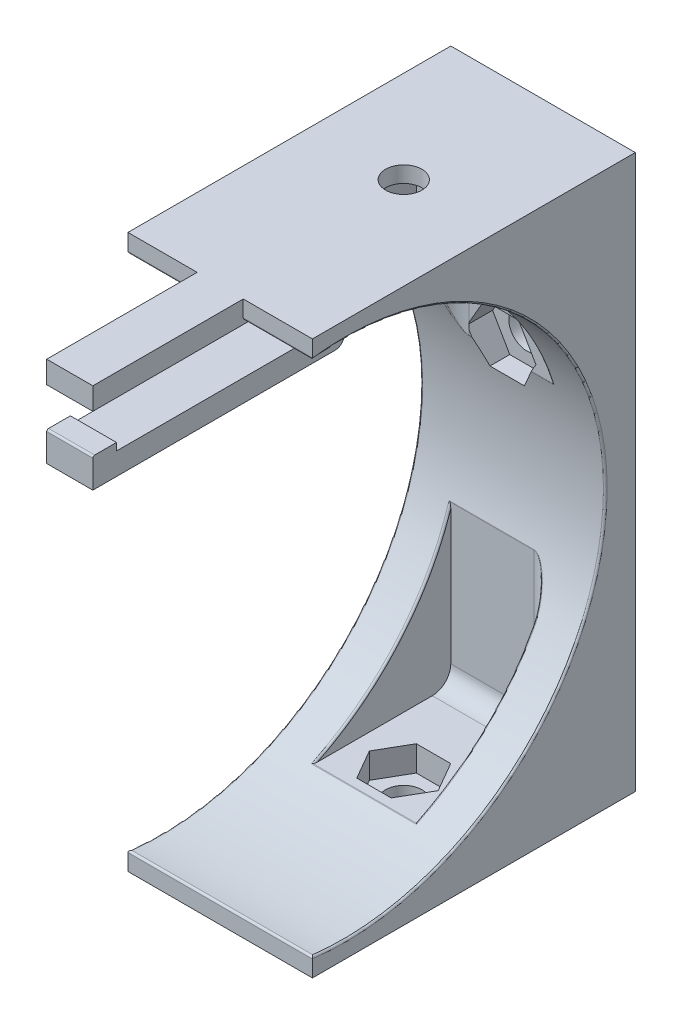
from build123d import *

# Parameters (mm, degrees)
SKETCH1_W               = 25.4
SKETCH1_H               = 76.2
BOSS_EXTRUDE1_DEPTH     = 44.45
SHELL1_T                = -5.715
CUT_EXTRUDE3_DEPTH      = 64.816710194
CUT_EXTRUDE3_DEPTH_BACK = 64.816710194
CUT_EXTRUDE4_DEPTH      = 90.126497182
CUT_EXTRUDE4_DEPTH_BACK = 90.126497182
SKETCH4_R               = 2.5
CUT_EXTRUDE5_DEPTH      = 56.796955338
CUT_EXTRUDE5_DEPTH_BACK = 56.796955338
SKETCH5_R               = 2.5
FILLET1_R               = 2.54
FILLET2_R               = 0.254
SKETCH7_R               = 2.5
CUT_EXTRUDE6_DEPTH      = 3.5
SKETCH8_R               = 2.5
CUT_EXTRUDE7_DEPTH      = 3.5
CUT_EXTRUDE8_START      = -3.5
SKETCH9_R               = 2.5
CUT_EXTRUDE8_DEPTH      = 3.5
SKETCH10_W              = 2.54
SKETCH10_H              = 6.35
BOSS_EXTRUDE2_DEPTH     = 3.175


with BuildPart() as part:
    # Sketch1 → Boss-Extrude1 (new body)
    with BuildSketch(Plane.XY):
        Rectangle(SKETCH1_W, SKETCH1_H)
    extrude(amount=BOSS_EXTRUDE1_DEPTH)

    # Shell1
    shell1_openings = [part.faces().sort_by_distance(p)[0] for p in [
        (0, 0, 44.45),
    ]]
    offset(amount=SHELL1_T, openings=shell1_openings, kind=Kind.INTERSECTION)

    # Sketch2 → Cut-Extrude3 (cut, two sides: drawn at the far end of the back side and taken through both)
    with BuildSketch(Plane(origin=(12.7, 0, 0), x_dir=(0, 0, -1), z_dir=(1, 0, 0)).offset(-CUT_EXTRUDE3_DEPTH_BACK)):
        with BuildLine():
            ThreePointArc((-36.413720818, -35.664362817), (-4.128213539, 0), (-36.413720818, 35.664362817))
            Line((-36.413720818, 35.664362817), (-36.413720818, -35.664362817))
        make_face()
        with BuildLine():
            Line((-36.413720818, -35.664362817), (-36.413720818, 35.664362817))
            ThreePointArc((-36.413720818, 35.664362817), (-40.434794926, 35.838148814), (-44.45, 35.56))
            Line((-44.45, 35.56), (-44.45, -35.56))
            ThreePointArc((-44.45, -35.56), (-40.434794926, -35.838148814), (-36.413720818, -35.664362817))
        make_face()
    extrude(amount=CUT_EXTRUDE3_DEPTH + CUT_EXTRUDE3_DEPTH_BACK, mode=Mode.SUBTRACT)

    # Sketch4 → Cut-Extrude4 (cut, two sides: drawn at the far end of the back side and taken through both)
    with BuildSketch(Plane(origin=(0, 38.1, 0), x_dir=(1, 0, 0), z_dir=(0, 1, 0)).offset(-CUT_EXTRUDE4_DEPTH_BACK)):
        with Locations(Location((0, -19.177, 0), (0, 0, 270))):
            Circle(SKETCH4_R)
    extrude(amount=CUT_EXTRUDE4_DEPTH + CUT_EXTRUDE4_DEPTH_BACK, mode=Mode.SUBTRACT)

    # Sketch5 → Cut-Extrude5 (cut, two sides: drawn at the far end of the back side and taken through both)
    with BuildSketch(Plane.XY.offset(5.715).offset(-CUT_EXTRUDE5_DEPTH_BACK)):
        with Locations((0, 11.684)):
            Circle(SKETCH5_R)
    extrude(amount=CUT_EXTRUDE5_DEPTH + CUT_EXTRUDE5_DEPTH_BACK, mode=Mode.SUBTRACT)

    # Fillet1
    fillet1_edges = [part.edges().sort_by_distance(p)[0] for p in [
        (6.985, -21.465702955, 5.715),
        (0, 32.385, 5.715),
        (-6.985, 21.465702955, 5.715),
        (0, -32.385, 5.715),
    ]]
    fillet(fillet1_edges, radius=FILLET1_R)

    # Fillet2
    fillet2_edges = [part.edges().sort_by_distance(p)[0] for p in [
        (-6.985, -23.45347117, 12.867277174),
        (0, -32.385, 24.613561487),
        (6.985, -25.868117579, 15.161522376),
        (6.985, 23.45347117, 12.867277174),
        (0, 32.385, 24.613561487),
        (-6.985, 25.868117579, 15.161522376),
        (12.7, 0, 4.128213539),
        (0, 35.56, 44.45),
        (0, -35.56, 44.45),
        (-12.7, 0, 4.128213539),
        (4.605590257, 10.546405909, 5.715),
        (0, 9.184, 5.32485132),
        (-3.335590257, 10.546405909, 5.715),
        (-1.27, -10.546405909, 5.715),
        (6.453749337, -13.333029038, 6.700482035),
        (-6.453749331, 13.333029041, 6.700482036),
    ]]
    fillet(fillet2_edges, radius=FILLET2_R)

    # Sketch7 → Cut-Extrude6 (cut)
    with BuildSketch(Plane(origin=(0, -32.385, 0), x_dir=(1, 0, 0), z_dir=(0, 1, 0))):
        Polygon((-2.367136104, -23.277), (2.367136104, -23.277), (4.734272207, -19.177), (2.367136104, -15.077), (-2.367136104, -15.077), (-4.734272207, -19.177), align=None)
        with Locations(Location((0, -19.177, 0), (0, 0, 270))):
            Circle(SKETCH7_R, mode=Mode.SUBTRACT)
    extrude(amount=-CUT_EXTRUDE6_DEPTH, mode=Mode.SUBTRACT)

    # Sketch8 → Cut-Extrude7 (cut)
    with BuildSketch(Plane.XY.offset(5.715)):
        Polygon((4.734272207, 11.684), (2.367136104, 15.784), (-2.367136104, 15.784), (-4.734272207, 11.684), (-2.367136104, 7.584), (2.367136104, 7.584), align=None)
        with Locations((0, 11.684)):
            Circle(SKETCH8_R, mode=Mode.SUBTRACT)
    extrude(amount=-CUT_EXTRUDE7_DEPTH, mode=Mode.SUBTRACT)

    # Sketch9 → Cut-Extrude8 (cut)
    with BuildSketch(Plane.XZ.offset(-32.385).offset(CUT_EXTRUDE8_START)):
        Polygon((2.367136104, 15.077), (4.734272207, 19.177), (2.367136104, 23.277), (-2.367136104, 23.277), (-4.734272207, 19.177), (-2.367136104, 15.077), align=None)
        with Locations(Location((0, 19.177, 0), (0, 0, 90))):
            Circle(SKETCH9_R, mode=Mode.SUBTRACT)
    extrude(amount=CUT_EXTRUDE8_DEPTH, mode=Mode.SUBTRACT)

    # Sketch10 → Boss-Extrude2 (add, symmetric)
    with BuildSketch(Plane(origin=(0, 0, 0), x_dir=(0, 0, -1), z_dir=(1, 0, 0))):
        Polygon((-30.529506667, 35.052), (-30.529506667, 38.1), (-65.157426577, 38.1), (-65.157426577, 35.052), (-33.069506667, 35.052), align=None)
        with Locations((-31.799506667, 31.877)):
            Rectangle(SKETCH10_W, SKETCH10_H)
        with BuildLine():
            Line((-30.529506667, 26.924), (-30.529506667, 28.702))
            Line((-30.529506667, 28.702), (-33.069506667, 28.702))
            Line((-33.069506667, 28.702), (-61.900873737, 28.702))
            Line((-61.900873737, 28.702), (-65.157426577, 28.702))
            Line((-65.157426577, 28.702), (-65.157426577, 25.654))
            Line((-65.157426577, 25.654), (-31.799506667, 25.654))
            ThreePointArc((-31.799506667, 25.654), (-30.901481055, 26.025974388), (-30.529506667, 26.924))
        make_face()
        with BuildLine():
            Line((-65.157426577, 28.702), (-61.900873737, 28.702))
            Line((-61.900873737, 28.702), (-61.900873737, 29.718))
            Line((-61.900873737, 29.718), (-64.903426577, 29.718))
            ThreePointArc((-64.903426577, 29.718), (-65.083031699, 29.643605122), (-65.157426577, 29.464))
            Line((-65.157426577, 29.464), (-65.157426577, 28.702))
        make_face()
    extrude(amount=BOSS_EXTRUDE2_DEPTH, both=True)


solid = part.part
